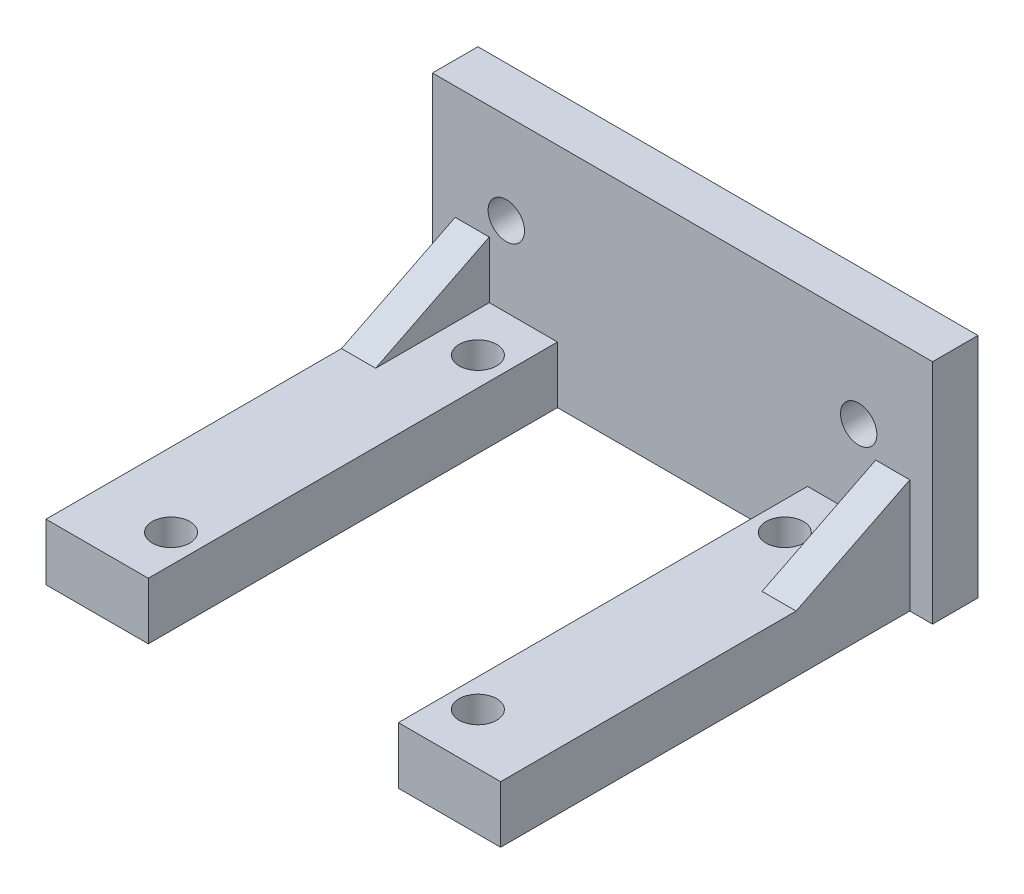
from build123d import *

# Parameters (mm, degrees)
SKETCH_1_R      = 1.65
EXTRUDE_1_DEPTH = 5
SKETCH_2_W      = 44
SKETCH_2_H      = 20
SKETCH_2_R      = 1.6
EXTRUDE_2_DEPTH = 4
EXTRUDE_4_DEPTH = 3
EXTRUDE_5_DEPTH = 3
EXTRUDE_6_DEPTH = 3


with BuildPart() as part:
    # 草图1 → 凸台-拉伸1 (new body)
    with BuildSketch(Plane(origin=(0, 0, 0), x_dir=(1, 0, 0), z_dir=(0, 1, 0))):
        Polygon((-20, 20), (20, 20), (20, -20), (11, -20), (11, 16), (-11, 16), (-11, -20), (-20, -20), align=None)
        with Locations(Location((-13.5, -15.5, 0), (0, 0, 270))):
            Circle(SKETCH_1_R, mode=Mode.SUBTRACT)
        with Locations(Location((13.5, -15.5, 0), (0, 0, 90))):
            Circle(SKETCH_1_R, mode=Mode.SUBTRACT)
        with Locations(Location((13.5, 11.5, 0), (0, 0, 270))):
            Circle(SKETCH_1_R, mode=Mode.SUBTRACT)
        with Locations(Location((-13.5, 11.5, 0), (0, 0, 90))):
            Circle(SKETCH_1_R, mode=Mode.SUBTRACT)
    extrude(amount=EXTRUDE_1_DEPTH)

    # 草图2 → 凸台-拉伸2 (add)
    with BuildSketch(Plane(origin=(0, 0, -20), x_dir=(-1, 0, 0), z_dir=(0, 0, -1))):
        with Locations((0, 10)):
            Rectangle(SKETCH_2_W, SKETCH_2_H)
        with Locations((-15.5, 12)):
            Circle(SKETCH_2_R, mode=Mode.SUBTRACT)
        with Locations(Location((15.5, 12, 0), (0, 0, 180))):
            Circle(SKETCH_2_R, mode=Mode.SUBTRACT)
    extrude(amount=-EXTRUDE_2_DEPTH)

    # 草图4 → 凸台-拉伸4 (add)
    with BuildSketch(Plane.ZY.offset(20)):
        Polygon((-16, 0), (-6, 5), (-16, 5), align=None)
    extrude(amount=-EXTRUDE_4_DEPTH)

    # 草图5 → 凸台-拉伸5 (add)
    with BuildSketch(Plane(origin=(20, 0, 0), x_dir=(0, 0, -1), z_dir=(1, 0, 0))):
        Polygon((16, 10), (6, 5), (16, 5), align=None)
    extrude(amount=-EXTRUDE_5_DEPTH)

    # 草图6 → 凸台-拉伸6 (add)
    with BuildSketch(Plane.ZY.offset(20)):
        Polygon((-16, 10), (-16, 5), (-6, 5), align=None)
    extrude(amount=-EXTRUDE_6_DEPTH)


solid = part.part
